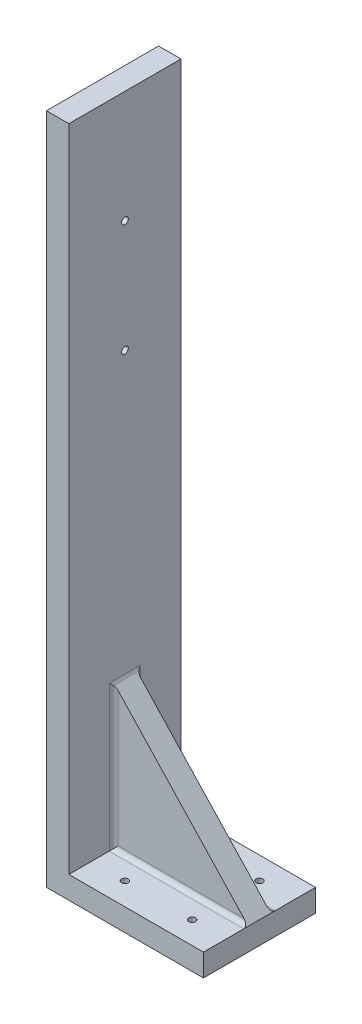
from build123d import *

# Parameters (mm, degrees)
BOSS_EXTRUDE1_DEPTH = 25
SKETCH2_W           = 10
SKETCH2_H           = 64.104672306
BOSS_EXTRUDE2_DEPTH = 60
CUT_EXTRUDE1_DEPTH  = 60
SKETCH4_R           = 1.5
CUT_EXTRUDE2_DEPTH  = 60
FILLET1_R           = 2
SKETCH13_R          = 1.5
CUT_EXTRUDE3_DEPTH  = 10


with BuildPart() as part:
    # Sketch1 → Boss-Extrude1 (new, symmetric)
    with BuildSketch(Plane.XY):
        Polygon((0, 76.71875), (-10, 76.71875), (-10, -223.28125), (60, -223.28125), (60, -213.28125), (0, -213.28125), align=None)
    extrude(amount=BOSS_EXTRUDE1_DEPTH, both=True)

    # Sketch2 → Boss-Extrude2 (add)
    with BuildSketch(Plane(origin=(0, 0, 0), x_dir=(0, 0, -1), z_dir=(1, 0, 0))):
        with Locations((0, -181.228913847)):
            Rectangle(SKETCH2_W, SKETCH2_H)
    extrude(amount=BOSS_EXTRUDE2_DEPTH)

    # Sketch3 → Cut-Extrude1 (cut)
    with BuildSketch(Plane.XY.offset(5)):
        Polygon((0, -149.176577694), (60, -213.28125), (60, -149.176577694), align=None)
    extrude(amount=-CUT_EXTRUDE1_DEPTH, mode=Mode.SUBTRACT)

    # Sketch4 → Cut-Extrude2 (cut)
    with BuildSketch(Plane(origin=(0, -213.28125, 0), x_dir=(1, 0, 0), z_dir=(0, 1, 0))):
        with Locations(Location((15, 15, 0), (0, 0, 270))):
            Circle(SKETCH4_R)
        with Locations(Location((15, -15, 0), (0, 0, 270))):
            Circle(SKETCH4_R)
        with Locations(Location((45, -15, 0), (0, 0, 270))):
            Circle(SKETCH4_R)
        with Locations(Location((45, 15, 0), (0, 0, 270))):
            Circle(SKETCH4_R)
    extrude(amount=-CUT_EXTRUDE2_DEPTH, mode=Mode.SUBTRACT)

    # Fillet1
    fillet1_edges = [part.edges().sort_by_distance(p)[0] for p in [
        (0, -181.228913847, 5),
        (30, -213.28125, 5),
        (0, -181.228913847, -5),
        (30, -213.28125, -5),
        (0, -149.176577694, 0),
    ]]
    fillet(fillet1_edges, radius=FILLET1_R)

    # Sketch13 → Cut-Extrude3 (cut)
    with BuildSketch(Plane(origin=(0, 0, 0), x_dir=(0, 0, -1), z_dir=(1, 0, 0))):
        with Locations(Location((0, 26.71875, 0), (0, 0, 90))):
            Circle(SKETCH13_R)
        with Locations(Location((0, -23.28125, 0), (0, 0, 90))):
            Circle(SKETCH13_R)
    extrude(amount=-CUT_EXTRUDE3_DEPTH, mode=Mode.SUBTRACT)


solid = part.part
